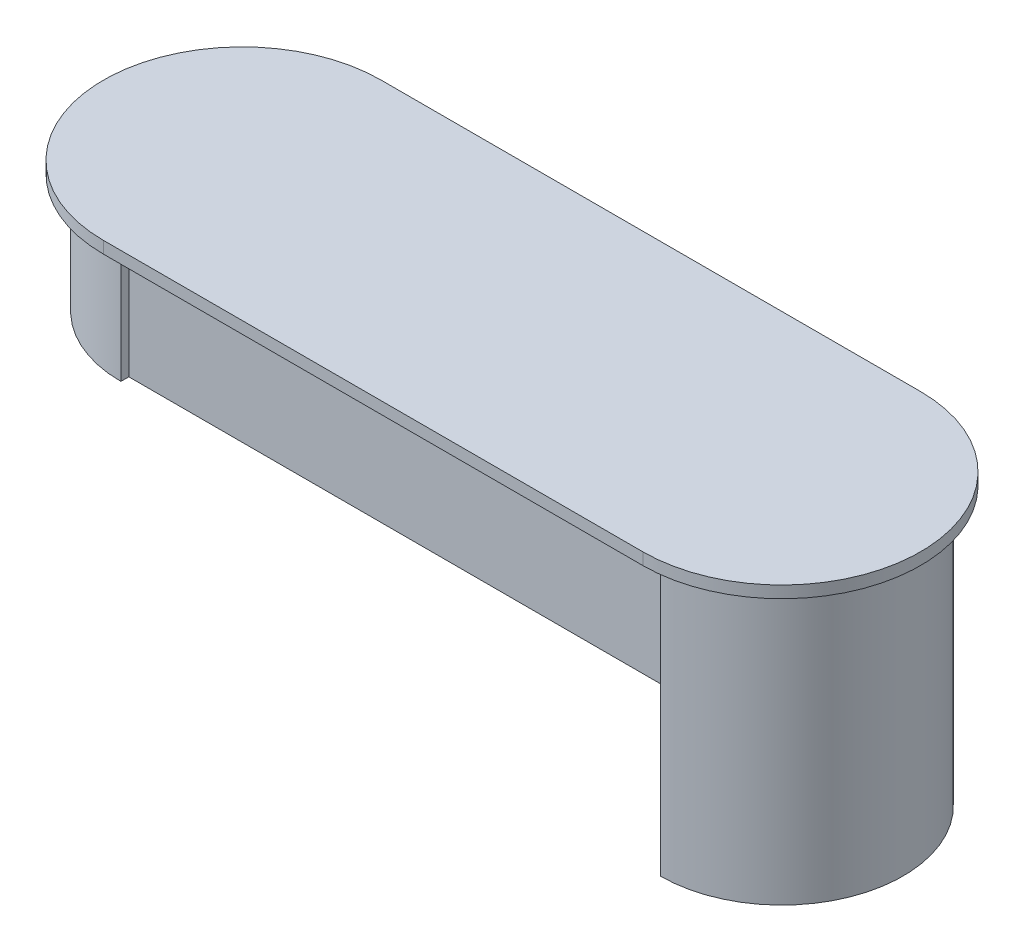
from build123d import *

# Parameters (mm, degrees)
EXTRUDE_1_DEPTH     = 3
EXTRUDE_1_2_DEPTH   = 0.3
EXTRUDE_START       = 2.5
EXTRUDE_2_DEPTH     = 2.5
CUT_EXTRUDE_1_DEPTH = 4.52
EXTRUDE_START_2     = 4
EXTRUDE_2_2_DEPTH   = 4
SKETCH_6_W          = 13.6
SKETCH_6_H          = 0.2
CUT_EXTRUDE_2_DEPTH = 3


with BuildPart() as part:
    # Эскиз1 → Extrude 1 (new body)
    with BuildSketch(Plane(origin=(0, 0, 0), x_dir=(1, 0, 0), z_dir=(0, 1, 0))):
        with BuildLine():
            Line((13.6, -3.06), (0, -3.06))
            ThreePointArc((0, -3.06), (-3.06, 0), (0, 3.06))
            Line((0, 3.06), (13.6, 3.06))
            ThreePointArc((13.6, 3.06), (16.66, 0), (13.6, -3.06))
        make_face()
        with BuildLine():
            Line((13.6, -2.26), (0, -2.26))
            ThreePointArc((0, -2.26), (-2.26, 0), (0, 2.26))
            Line((0, 2.26), (13.6, 2.26))
            ThreePointArc((13.6, 2.26), (15.86, 0), (13.6, -2.26))
        make_face(mode=Mode.SUBTRACT)
    extrude(amount=EXTRUDE_1_DEPTH)

    # Эскиз2 → Extrude 1 2 (add)
    with BuildSketch(Plane(origin=(0, 3, 0), x_dir=(1, 0, 0), z_dir=(0, 1, 0))):
        with BuildLine():
            Line((0, 3.5), (13.6, 3.5))
            ThreePointArc((13.6, 3.5), (17.1, 0), (13.6, -3.5))
            Line((13.6, -3.5), (0, -3.5))
            ThreePointArc((0, -3.5), (-3.5, 0), (0, 3.5))
        make_face()
    extrude(amount=EXTRUDE_1_2_DEPTH)

    # Эскиз3 → Extrude 2 (add)
    with BuildSketch(Plane.XZ.offset(-3).offset(EXTRUDE_START)):
        with BuildLine():
            Line((0, -2.26), (2, -2.26))
            Line((2, -2.26), (2, 2.26))
            Line((2, 2.26), (0, 2.26))
            ThreePointArc((0, 2.26), (-2.26, 0), (0, -2.26))
        make_face()
    extrude(amount=-EXTRUDE_2_DEPTH)

    # Эскиз4 → Вырез-Вытянуть1 (cut)
    with BuildSketch(Plane.XY.offset(-2.26)):
        Polygon((2, 3), (0.2, 3), (2, 1.2), align=None)
    extrude(amount=CUT_EXTRUDE_1_DEPTH, mode=Mode.SUBTRACT)

    # Эскиз5 → Extrude 2 2 (add)
    with BuildSketch(Plane.XZ.offset(EXTRUDE_START_2)):
        with BuildLine():
            ThreePointArc((13.6, -2.26), (15.86, 0), (13.6, 2.26))
            Line((13.6, 2.26), (13.6, 3.06))
            ThreePointArc((13.6, 3.06), (16.66, 0), (13.6, -3.06))
            Line((13.6, -3.06), (13.6, -2.26))
        make_face()
    extrude(amount=-EXTRUDE_2_2_DEPTH)

    # Эскиз6 → Вырез-Вытянуть2 (cut)
    with BuildSketch(Plane.XZ):
        with Locations((6.8, 2.96)):
            Rectangle(SKETCH_6_W, SKETCH_6_H)
        with Locations((6.8, -2.96)):
            Rectangle(SKETCH_6_W, SKETCH_6_H)
    extrude(amount=-CUT_EXTRUDE_2_DEPTH, mode=Mode.SUBTRACT)


solid = part.part
